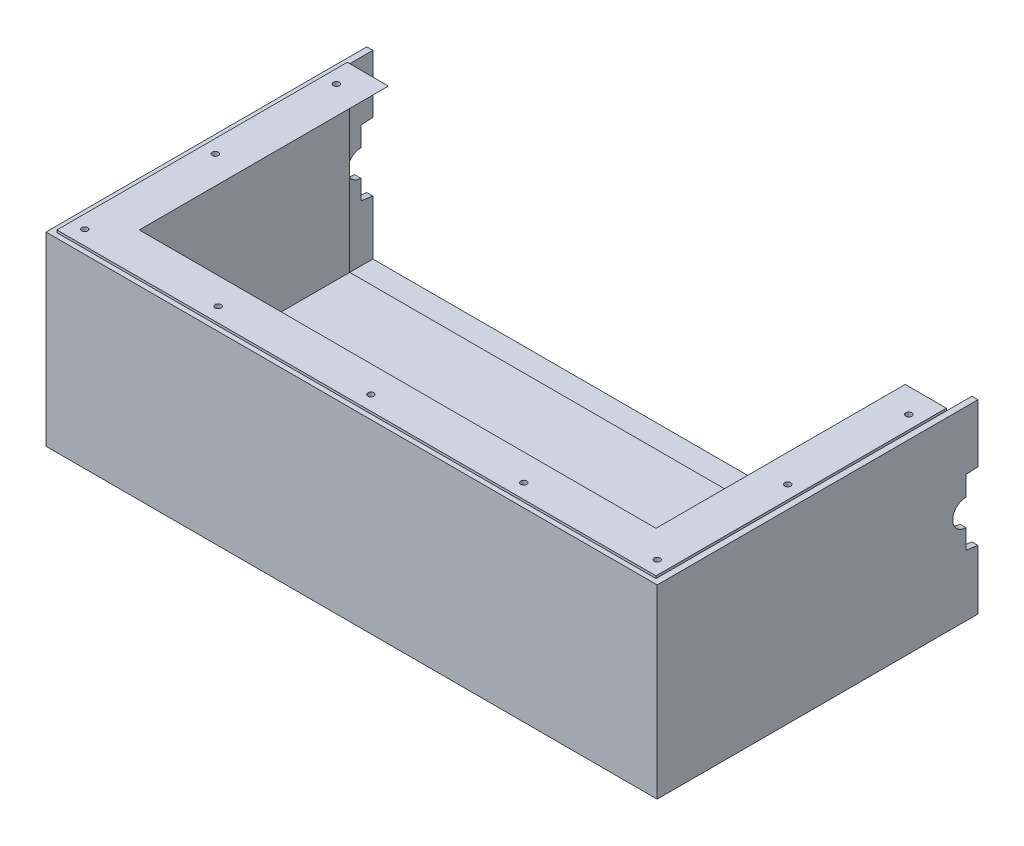
from build123d import *

# Parameters (mm, degrees)
SKETCH1_W               = 247.42
SKETCH1_H               = 129.49
SKETCH1_R               = 4
SKETCH1_W_2             = 2.5
SKETCH1_R_2             = 1.25
BOSS_EXTRUDE1_DEPTH     = 2
BOSS_EXTRUDE2_START     = 2
SKETCH1_6_R             = 4
SKETCH1_6_R_2           = 1.25
BOSS_EXTRUDE2_DEPTH     = 11.7
BOSS_EXTRUDE3_START     = 2
SKETCH1_7_W             = 2.5
SKETCH1_7_H             = 129.49
BOSS_EXTRUDE3_DEPTH     = 75.64
SKETCH2_W               = 247.42
SKETCH2_H               = 118.92
BOSS_EXTRUDE4_DEPTH     = 1
SKETCH3_W               = 118.92
SKETCH3_H               = 74.64
BOSS_EXTRUDE5_DEPTH     = 1
SKETCH4_W               = 118.92
SKETCH4_H               = 74.64
BOSS_EXTRUDE6_DEPTH     = 1
CUT_EXTRUDE1_DEPTH      = 296.461378356
CUT_EXTRUDE1_DEPTH_BACK = 296.461378356
BOSS_EXTRUDE7_DEPTH     = 118.92
BOSS_EXTRUDE8_REACH     = 297.461
CUT_EXTRUDE2_REACH      = 295.328
SKETCH8_R               = 1.25
SKETCH9_W               = 247.42
SKETCH9_H               = 2
CUT_EXTRUDE3_DEPTH      = 1


with BuildPart() as part:
    # Sketch1 → Boss-Extrude1 (new body)
    # profile 1 of 6: a face of its own
    with BuildSketch(Plane(origin=(0, 0, 0), x_dir=(1, 0, 0), z_dir=(0, 1, 0))):
        with Locations((123.71, -64.745)):
            Rectangle(SKETCH1_W, SKETCH1_H)
        with Locations((48.85, -123.16)):
            Circle(SKETCH1_R, mode=Mode.SUBTRACT)
        with Locations((233.87, -123.16)):
            Circle(SKETCH1_R, mode=Mode.SUBTRACT)
    # profile 2 of 6: a face of its own
    with BuildSketch(Plane(origin=(0, 0, 0), x_dir=(1, 0, 0), z_dir=(0, 1, 0))):
        with Locations((-1.25, -64.745)):
            Rectangle(SKETCH1_W_2, SKETCH1_H)
    # profile 3 of 6: a face of its own
    with BuildSketch(Plane(origin=(0, 0, 0), x_dir=(1, 0, 0), z_dir=(0, 1, 0))):
        Polygon((249.92, -129.49), (249.92, -132.49), (-2.5, -132.49), (-2.5, -129.49), (0, -129.49), (247.42, -129.49), align=None)
    # profile 4 of 6: a face of its own
    with BuildSketch(Plane(origin=(0, 0, 0), x_dir=(1, 0, 0), z_dir=(0, 1, 0))):
        with Locations((248.67, -64.745)):
            Rectangle(SKETCH1_W_2, SKETCH1_H)
    # profile 5 of 6: a face of its own
    with BuildSketch(Plane(origin=(0, 0, 0), x_dir=(1, 0, 0), z_dir=(0, 1, 0))):
        with Locations((233.87, -123.16)):
            Circle(SKETCH1_R)
        with Locations(Location((233.87, -123.16, 0), (0, 0, 270))):
            Circle(SKETCH1_R_2, mode=Mode.SUBTRACT)
    # profile 6 of 6: a face of its own
    with BuildSketch(Plane(origin=(0, 0, 0), x_dir=(1, 0, 0), z_dir=(0, 1, 0))):
        with Locations((48.85, -123.16)):
            Circle(SKETCH1_R)
        with Locations(Location((48.85, -123.16, 0), (0, 0, 270))):
            Circle(SKETCH1_R_2, mode=Mode.SUBTRACT)
    extrude(amount=BOSS_EXTRUDE1_DEPTH)

    # Sketch1<6> → Boss-Extrude2 (add)
    # profile 1 of 2: a face of its own
    with BuildSketch(Plane(origin=(0, 0, 0), x_dir=(1, 0, 0), z_dir=(0, 1, 0)).offset(BOSS_EXTRUDE2_START)):
        with Locations(Location((48.85, -123.16, 0), (0, 0, 270))):
            Circle(SKETCH1_6_R)
        with Locations(Location((48.85, -123.16, 0), (0, 0, 270))):
            Circle(SKETCH1_6_R_2, mode=Mode.SUBTRACT)
    # profile 2 of 2: a face of its own
    with BuildSketch(Plane(origin=(0, 0, 0), x_dir=(1, 0, 0), z_dir=(0, 1, 0)).offset(BOSS_EXTRUDE2_START)):
        with Locations(Location((233.87, -123.16, 0), (0, 0, 270))):
            Circle(SKETCH1_6_R)
        with Locations(Location((233.87, -123.16, 0), (0, 0, 270))):
            Circle(SKETCH1_6_R_2, mode=Mode.SUBTRACT)
    extrude(amount=BOSS_EXTRUDE2_DEPTH)

    # Sketch1<7> → Boss-Extrude3 (add)
    with BuildSketch(Plane(origin=(0, 0, 0), x_dir=(1, 0, 0), z_dir=(0, 1, 0)).offset(BOSS_EXTRUDE3_START)):
        with Locations((-1.25, -64.745)):
            Rectangle(SKETCH1_7_W, SKETCH1_7_H)
        Polygon((249.92, -129.49), (249.92, -132.49), (-2.5, -132.49), (-2.5, -129.49), (0, -129.49), (247.42, -129.49), align=None)
        with Locations((248.67, -64.745)):
            Rectangle(SKETCH1_7_W, SKETCH1_7_H)
    extrude(amount=BOSS_EXTRUDE3_DEPTH)

    # Sketch2 → Boss-Extrude4 (add)
    with BuildSketch(Plane(origin=(0, 2, 0), x_dir=(1, 0, 0), z_dir=(0, 1, 0))):
        with Locations((123.71, -70.03)):
            Rectangle(SKETCH2_W, SKETCH2_H)
    extrude(amount=BOSS_EXTRUDE4_DEPTH)

    # Sketch3 → Boss-Extrude5 (add)
    with BuildSketch(Plane(origin=(0, 0, 0), x_dir=(0, 0, -1), z_dir=(1, 0, 0))):
        with Locations((-70.03, 40.32)):
            Rectangle(SKETCH3_W, SKETCH3_H)
    extrude(amount=BOSS_EXTRUDE5_DEPTH)

    # Sketch4 → Boss-Extrude6 (add)
    with BuildSketch(Plane.ZY.offset(-247.42)):
        with Locations((70.03, 40.32)):
            Rectangle(SKETCH4_W, SKETCH4_H)
    extrude(amount=BOSS_EXTRUDE6_DEPTH)

    # Sketch5 → Cut-Extrude1 (cut, two sides: drawn at the far end of the back side and taken through both)
    with BuildSketch(Plane(origin=(249.92, 0, 0), x_dir=(0, 0, -1), z_dir=(1, 0, 0)).offset(-CUT_EXTRUDE1_DEPTH_BACK)):
        Polygon((-5, 25.285), (0, 24.52), (0, 52.64), (-5, 52.355), (-5, 44.245), (-5, 33.395), align=None)
        with BuildLine():
            ThreePointArc((-5, 44.245), (-10.425, 38.82), (-5, 33.395))
            Line((-5, 33.395), (-5, 44.245))
        make_face()
    extrude(amount=CUT_EXTRUDE1_DEPTH + CUT_EXTRUDE1_DEPTH_BACK, mode=Mode.SUBTRACT)

    # Sketch6 → Boss-Extrude7 (add)
    with BuildSketch(Plane(origin=(0, 0, 129.49), x_dir=(-1, 0, 0), z_dir=(0, 0, -1))):
        Polygon((-246.42, 77.64), (-230.42, 77.64), (-246.42, 61.64), align=None)
        Polygon((-1, 77.64), (-17, 77.64), (-1, 61.64), align=None)
    extrude(amount=BOSS_EXTRUDE7_DEPTH)

    # Boss-Extrude8: up to this plane
    boss_extrude8_end = Plane(origin=(17, 77.64, -12.057416998), z_dir=(-0.7071067811865476, 0.7071067811865476, 0))
    # Sketch7 → Boss-Extrude8 (add, up to the surface)
    with BuildSketch(Plane(origin=(249.92, 0, 0), x_dir=(0, 0, -1), z_dir=(1, 0, 0)), mode=Mode.PRIVATE) as boss_extrude8_sk1:
        Polygon((-132.49, 77.64), (-132.49, 61.64), (-129.49, 61.64), (-113.49, 77.64), align=None)
    boss_extrude8_tool1 = split(extrude(boss_extrude8_sk1.sketch, amount=-BOSS_EXTRUDE8_REACH, mode=Mode.PRIVATE), bisect_by=boss_extrude8_end, keep=Keep.BOTH, mode=Mode.PRIVATE)
    add(boss_extrude8_tool1.solids().sort_by_distance((249.92, 71.579394, 126.020303))[0])

    # Sketch8 → Cut-Extrude2 (cut, up to next)
    with BuildSketch(Plane(origin=(0, 77.64, 0), x_dir=(1, 0, 0), z_dir=(0, 1, 0)), mode=Mode.PRIVATE) as cut_extrude2_sk1:
        with Locations(Location((5.5, -124.49, 0), (0, 0, 270))):
            Circle(SKETCH8_R)
    cut_extrude2_tool1 = extrude(cut_extrude2_sk1.sketch, amount=-CUT_EXTRUDE2_REACH, mode=Mode.PRIVATE) & part.part
    # Sketch8 → Cut-Extrude2 (cut, up to next)
    with BuildSketch(Plane(origin=(0, 77.64, 0), x_dir=(1, 0, 0), z_dir=(0, 1, 0)), mode=Mode.PRIVATE) as cut_extrude2_sk2:
        with Locations(Location((241.92, -124.49, 0), (0, 0, 270))):
            Circle(SKETCH8_R)
    cut_extrude2_tool2 = extrude(cut_extrude2_sk2.sketch, amount=-CUT_EXTRUDE2_REACH, mode=Mode.PRIVATE) & part.part
    # Sketch8 → Cut-Extrude2 (cut, up to next)
    with BuildSketch(Plane(origin=(0, 77.64, 0), x_dir=(1, 0, 0), z_dir=(0, 1, 0)), mode=Mode.PRIVATE) as cut_extrude2_sk3:
        with Locations(Location((60.605, -124.49, 0), (0, 0, 270))):
            Circle(SKETCH8_R)
    cut_extrude2_tool3 = extrude(cut_extrude2_sk3.sketch, amount=-CUT_EXTRUDE2_REACH, mode=Mode.PRIVATE) & part.part
    # Sketch8 → Cut-Extrude2 (cut, up to next)
    with BuildSketch(Plane(origin=(0, 77.64, 0), x_dir=(1, 0, 0), z_dir=(0, 1, 0)), mode=Mode.PRIVATE) as cut_extrude2_sk4:
        with Locations(Location((186.815, -124.49, 0), (0, 0, 270))):
            Circle(SKETCH8_R)
    cut_extrude2_tool4 = extrude(cut_extrude2_sk4.sketch, amount=-CUT_EXTRUDE2_REACH, mode=Mode.PRIVATE) & part.part
    # Sketch8 → Cut-Extrude2 (cut, up to next)
    with BuildSketch(Plane(origin=(0, 77.64, 0), x_dir=(1, 0, 0), z_dir=(0, 1, 0)), mode=Mode.PRIVATE) as cut_extrude2_sk5:
        with Locations(Location((123.71, -124.49, 0), (0, 0, 270))):
            Circle(SKETCH8_R)
    cut_extrude2_tool5 = extrude(cut_extrude2_sk5.sketch, amount=-CUT_EXTRUDE2_REACH, mode=Mode.PRIVATE) & part.part
    # Sketch8 → Cut-Extrude2 (cut, up to next)
    with BuildSketch(Plane(origin=(0, 77.64, 0), x_dir=(1, 0, 0), z_dir=(0, 1, 0)), mode=Mode.PRIVATE) as cut_extrude2_sk6:
        with Locations(Location((5.5, -70.57, 0), (0, 0, 270))):
            Circle(SKETCH8_R)
    cut_extrude2_tool6 = extrude(cut_extrude2_sk6.sketch, amount=-CUT_EXTRUDE2_REACH, mode=Mode.PRIVATE) & part.part
    # Sketch8 → Cut-Extrude2 (cut, up to next)
    with BuildSketch(Plane(origin=(0, 77.64, 0), x_dir=(1, 0, 0), z_dir=(0, 1, 0)), mode=Mode.PRIVATE) as cut_extrude2_sk7:
        with Locations(Location((5.5, -20.57, 0), (0, 0, 270))):
            Circle(SKETCH8_R)
    cut_extrude2_tool7 = extrude(cut_extrude2_sk7.sketch, amount=-CUT_EXTRUDE2_REACH, mode=Mode.PRIVATE) & part.part
    # Sketch8 → Cut-Extrude2 (cut, up to next)
    with BuildSketch(Plane(origin=(0, 77.64, 0), x_dir=(1, 0, 0), z_dir=(0, 1, 0)), mode=Mode.PRIVATE) as cut_extrude2_sk8:
        with Locations(Location((241.92, -20.57, 0), (0, 0, 270))):
            Circle(SKETCH8_R)
    cut_extrude2_tool8 = extrude(cut_extrude2_sk8.sketch, amount=-CUT_EXTRUDE2_REACH, mode=Mode.PRIVATE) & part.part
    # Sketch8 → Cut-Extrude2 (cut, up to next)
    with BuildSketch(Plane(origin=(0, 77.64, 0), x_dir=(1, 0, 0), z_dir=(0, 1, 0)), mode=Mode.PRIVATE) as cut_extrude2_sk9:
        with Locations(Location((241.92, -70.57, 0), (0, 0, 270))):
            Circle(SKETCH8_R)
    cut_extrude2_tool9 = extrude(cut_extrude2_sk9.sketch, amount=-CUT_EXTRUDE2_REACH, mode=Mode.PRIVATE) & part.part
    add(cut_extrude2_tool1.solids().sort_by_distance((5.5, 77.64, 124.49))[0], mode=Mode.SUBTRACT)
    add(cut_extrude2_tool2.solids().sort_by_distance((241.92, 77.64, 124.49))[0], mode=Mode.SUBTRACT)
    add(cut_extrude2_tool3.solids().sort_by_distance((60.605, 77.64, 124.49))[0], mode=Mode.SUBTRACT)
    add(cut_extrude2_tool4.solids().sort_by_distance((186.815, 77.64, 124.49))[0], mode=Mode.SUBTRACT)
    add(cut_extrude2_tool5.solids().sort_by_distance((123.71, 77.64, 124.49))[0], mode=Mode.SUBTRACT)
    add(cut_extrude2_tool6.solids().sort_by_distance((5.5, 77.64, 70.57))[0], mode=Mode.SUBTRACT)
    add(cut_extrude2_tool7.solids().sort_by_distance((5.5, 77.64, 20.57))[0], mode=Mode.SUBTRACT)
    add(cut_extrude2_tool8.solids().sort_by_distance((241.92, 77.64, 20.57))[0], mode=Mode.SUBTRACT)
    add(cut_extrude2_tool9.solids().sort_by_distance((241.92, 77.64, 70.57))[0], mode=Mode.SUBTRACT)

    # Sketch9 → Cut-Extrude3 (cut)
    with BuildSketch(Plane(origin=(0, 77.64, 0), x_dir=(1, 0, 0), z_dir=(0, 1, 0))):
        Polygon((0, 0), (-2.5, 0), (-2.5, -132.49), (0, -132.49), (0, -130.49), align=None)
        with Locations((123.71, -131.49)):
            Rectangle(SKETCH9_W, SKETCH9_H)
        Polygon((247.42, 0), (247.42, -130.49), (247.42, -132.49), (249.92, -132.49), (249.92, 0), align=None)
    extrude(amount=-CUT_EXTRUDE3_DEPTH, mode=Mode.SUBTRACT)


solid = part.part
